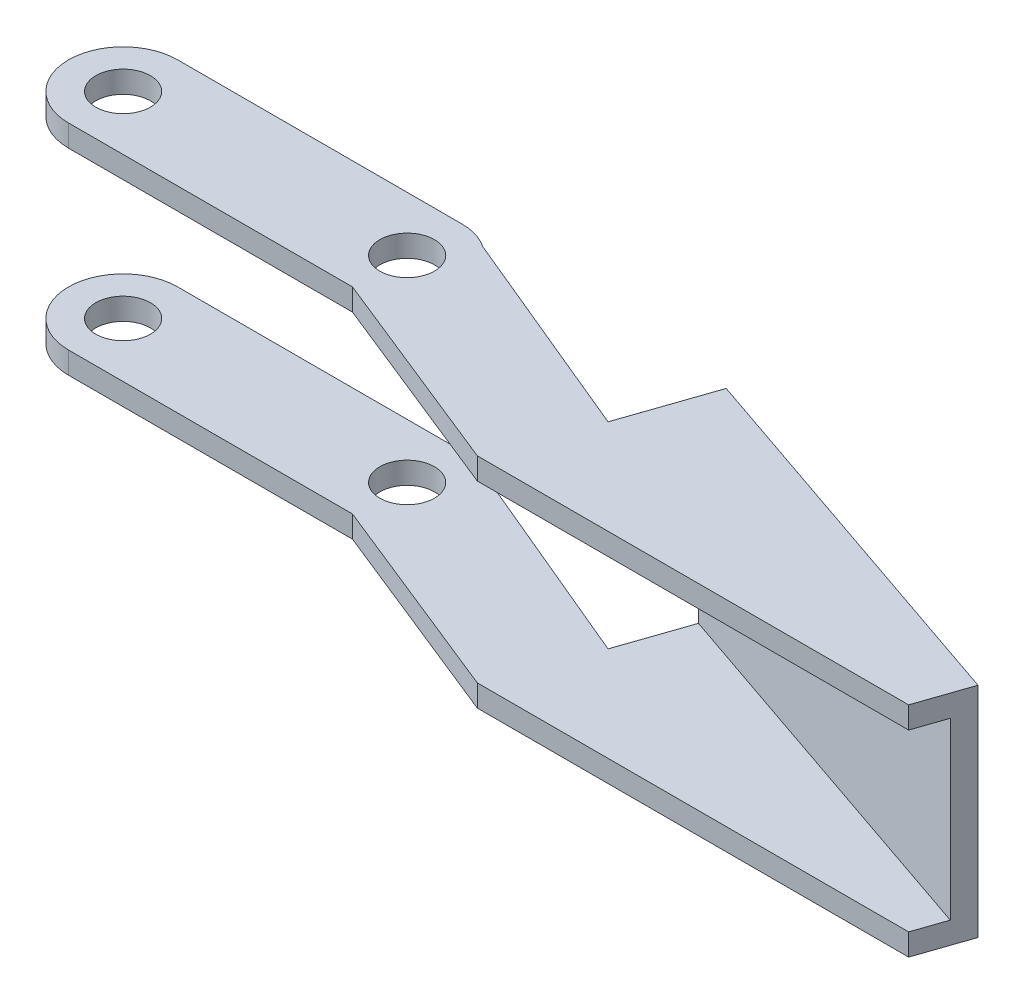
from build123d import *

# Parameters (mm, degrees)
SKETCH1_R           = 2.5
BOSS_EXTRUDE1_DEPTH = 2
BOSS_EXTRUDE2_DEPTH = 2
BOSS_EXTRUDE3_DEPTH = 16
BOSS_EXTRUDE4_START = 2
SKETCH5_R           = 2.5
BOSS_EXTRUDE4_DEPTH = 2


with BuildPart() as part:
    # Sketch1 → Boss-Extrude1 (new body)
    with BuildSketch(Plane(origin=(0, 0, 0), x_dir=(1, 0, 0), z_dir=(0, 1, 0))):
        with BuildLine():
            Line((0, 5), (26, 5))
            ThreePointArc((26, 5), (31, 0), (26, -5))
            Line((26, -5), (0, -5))
            ThreePointArc((0, -5), (-5, 0), (0, 5))
        make_face()
        with Locations(Location((0, 0, 0), (0, 0, 270))):
            Circle(SKETCH1_R, mode=Mode.SUBTRACT)
        with Locations(Location((26, 0, 0), (0, 0, 270))):
            Circle(SKETCH1_R, mode=Mode.SUBTRACT)
    extrude(amount=BOSS_EXTRUDE1_DEPTH)

    # Sketch3 → Boss-Extrude2 (add)
    with BuildSketch(Plane(origin=(0, 2, 0), x_dir=(1, 0, 0), z_dir=(0, 1, 0))):
        Polygon((28.797733135, 4.143994366), (48.392339972, -4.000005434), (51.150724408, 4.055463463), (86.204052601, -7.947631099), (84.584265263, -12.677989329), (45.103115949, -12.677989329), (26, -5), (30.045984746, -0.31879875), align=None)
    extrude(amount=-BOSS_EXTRUDE2_DEPTH)

    # Sketch4 → Boss-Extrude3 (add)
    with BuildSketch(Plane.XZ):
        Polygon((51.150724408, -4.055463463), (86.204052601, 7.947631099), (85.556137666, 9.839774391), (50.502809473, -2.163320171), align=None)
    extrude(amount=BOSS_EXTRUDE3_DEPTH)

    # Sketch5 → Boss-Extrude4 (add)
    with BuildSketch(Plane.XZ.offset(16).offset(BOSS_EXTRUDE4_START)):
        with BuildLine():
            Line((48.392339972, 4.000005434), (51.150724408, -4.055463463))
            Line((51.150724408, -4.055463463), (86.204052601, 7.947631099))
            Line((86.204052601, 7.947631099), (84.584265263, 12.677989329))
            Line((84.584265263, 12.677989329), (45.103115949, 12.677989329))
            Line((45.103115949, 12.677989329), (26, 5))
            Line((26, 5), (0, 5))
            ThreePointArc((0, 5), (-5, 0), (0, -5))
            Line((0, -5), (26, -5))
            ThreePointArc((26, -5), (26.739574604, -4.945000445), (27.462878698, -4.781211762))
            Line((27.462878698, -4.781211762), (28.386557924, -4.393670593))
            Line((28.386557924, -4.393670593), (48.392339972, 4.000005434))
        make_face()
        with Locations(Location((0, 0, 0), (0, 0, 90))):
            Circle(SKETCH5_R, mode=Mode.SUBTRACT)
        with Locations(Location((26, 0, 0), (0, 0, 90))):
            Circle(SKETCH5_R, mode=Mode.SUBTRACT)
    extrude(amount=-BOSS_EXTRUDE4_DEPTH)


solid = part.part
